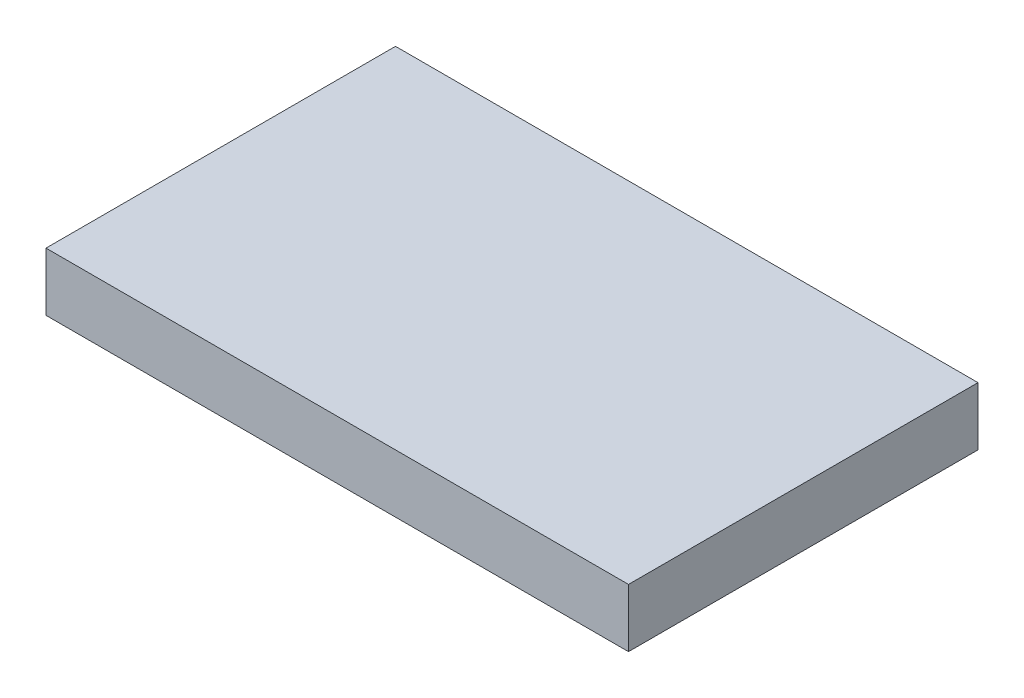
from build123d import *

# Parameters (mm, degrees)
SKETCH1_W             = 10
SKETCH1_H             = 6
BOSS_EXTRUDE1_DEPTH   = 1
BODY_MOVE_COPY1_ANGLE = 90


with BuildPart() as part:
    # Sketch1 → Boss-Extrude1 (new body)
    with BuildSketch(Plane.XY):
        with Locations((7.688888889, 13.105555556)):
            Rectangle(SKETCH1_W, SKETCH1_H)
    extrude(amount=BOSS_EXTRUDE1_DEPTH)


with BuildPart() as part_1:
    # Body-Move/Copy1: moved
    add(part.part.rotate(Axis((0, 13.105555556, 0.25), (1, 0, 0)), BODY_MOVE_COPY1_ANGLE))


solid = part_1.part
